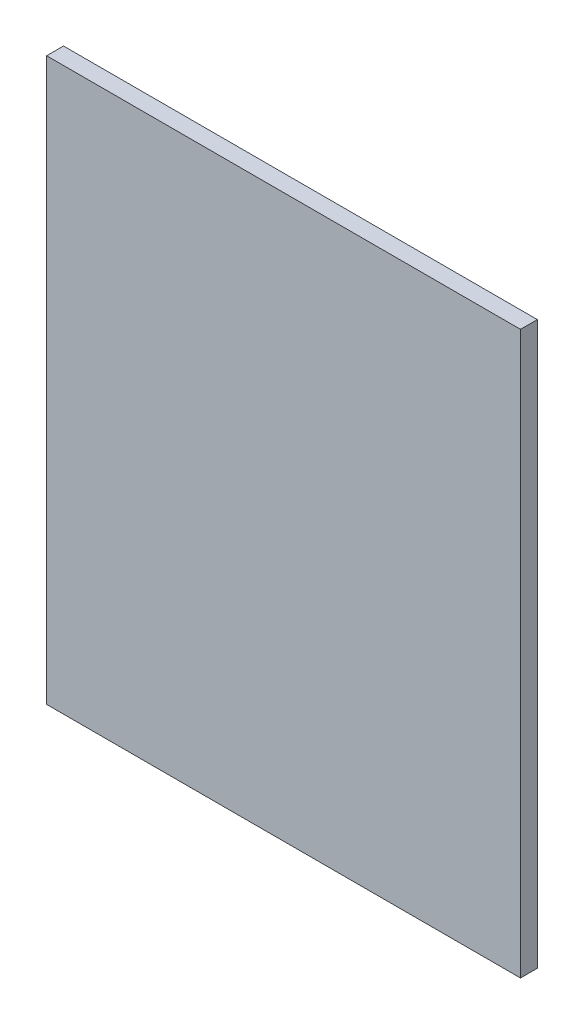
from build123d import *

# Parameters (mm, degrees)
ESQUISSE1_W        = 56.162552587
ESQUISSE1_H        = 66.580564028
BOSS_EXTRU_1_DEPTH = 2


with BuildPart() as part:
    # Esquisse1 → Boss.-Extru.1 (new body)
    with BuildSketch(Plane.XY):
        with Locations((28.081276294, 33.290282014)):
            Rectangle(ESQUISSE1_W, ESQUISSE1_H)
    extrude(amount=BOSS_EXTRU_1_DEPTH)


solid = part.part
